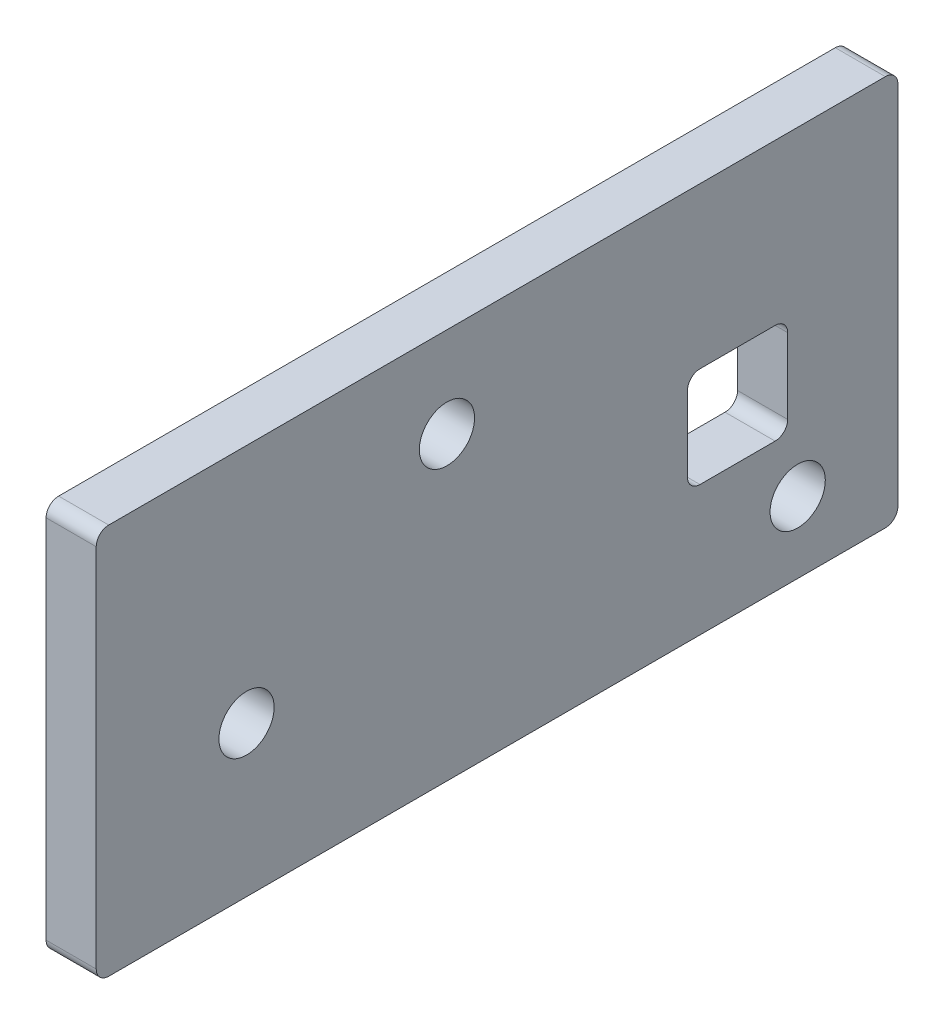
from build123d import *

# Parameters (mm, degrees)
SKETCH1_W           = 24.765
SKETCH1_H           = 50.8
SKETCH1_R           = 1.75
SKETCH1_W_2         = 6.35
SKETCH1_H_2         = 6.35
BOSS_EXTRUDE1_DEPTH = 3.175
FILLET1_R           = 0.79375


with BuildPart() as part:
    # Sketch1 → Boss-Extrude1 (new body)
    with BuildSketch(Plane.YZ):
        with Locations((-19.3675, 9.525)):
            Rectangle(SKETCH1_W, SKETCH1_H)
        with Locations(Location((-27.225, -9.525, 0), (0, 0, 270))):
            Circle(SKETCH1_R, mode=Mode.SUBTRACT)
        with Locations((-20.32, -5.715)):
            Rectangle(SKETCH1_W_2, SKETCH1_H_2, mode=Mode.SUBTRACT)
        with Locations(Location((-12.7, 12.7, 0), (0, 0, 270))):
            Circle(SKETCH1_R, mode=Mode.SUBTRACT)
        with Locations(Location((-22.225, 25.4, 0), (0, 0, 270))):
            Circle(SKETCH1_R, mode=Mode.SUBTRACT)
    extrude(amount=BOSS_EXTRUDE1_DEPTH)

    # Fillet1
    fillet1_edges = [part.edges().sort_by_distance(p)[0] for p in [
        (1.5875, -23.495, -2.54),
        (1.5875, -23.495, -8.89),
        (1.5875, -17.145, -8.89),
        (1.5875, -17.145, -2.54),
        (1.5875, -6.985, -15.875),
        (1.5875, -31.75, -15.875),
        (1.5875, -31.75, 34.925),
        (1.5875, -6.985, 34.925),
    ]]
    fillet(fillet1_edges, radius=FILLET1_R)


solid = part.part
